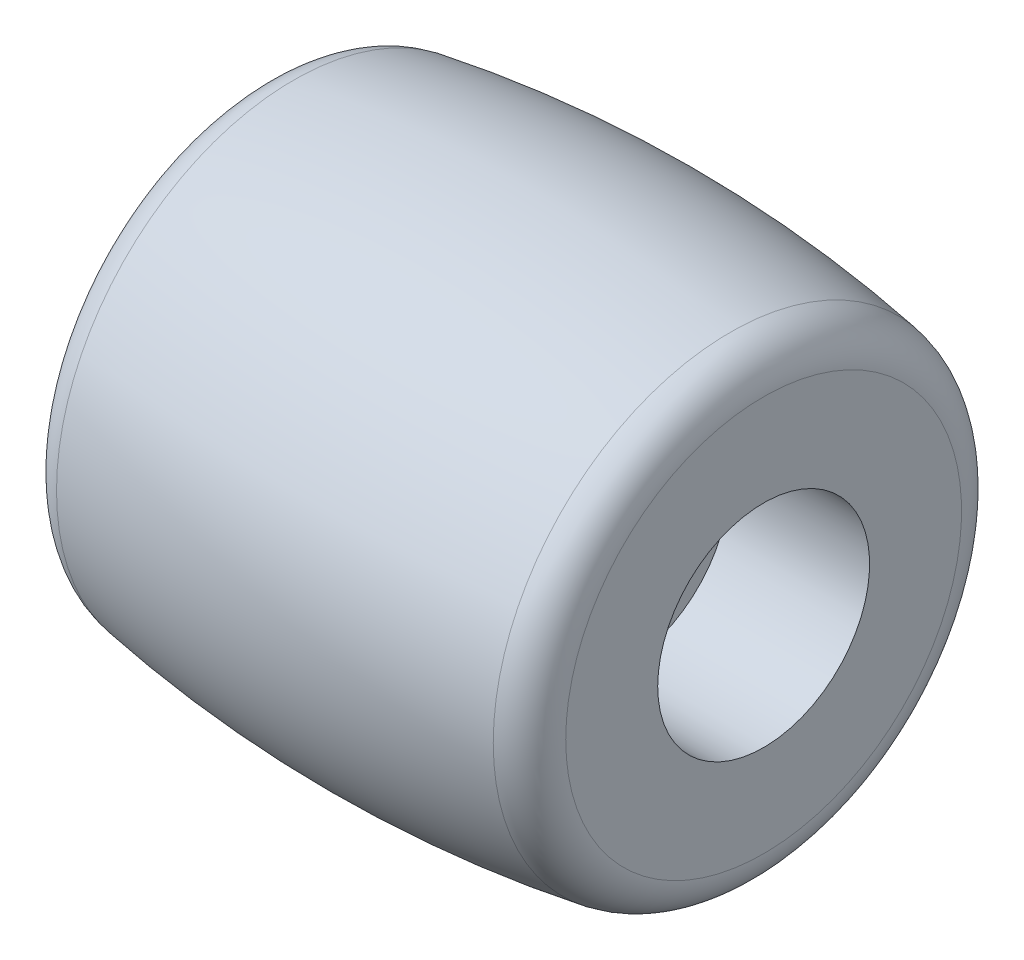
from build123d import *

# Parameters (mm, degrees)
FILLET_1_R = 1.5


with BuildPart() as part:
    # ｽｹｯﾁ1 → 回転1 (revolve)
    with BuildSketch(Plane.XY, mode=Mode.PRIVATE) as revolve_1_sk:
        with BuildLine():
            Line((4.2, 2.5), (-4.2, 2.5))
            Line((-4.2, 2.5), (-4.2, 4))
            Line((-4.2, 4), (-9.5, 4))
            Line((-9.5, 4), (-9.5, 8.72880747))
            ThreePointArc((-9.5, 8.72880747), (0, 9.625), (9.5, 8.72880747))
            Line((9.5, 8.72880747), (9.5, 4))
            Line((9.5, 4), (4.2, 4))
            Line((4.2, 4), (4.2, 2.5))
        make_face()
    revolve(revolve_1_sk.sketch.rotate(Axis((0, 0, 0), (1, 0, 0)), 90), axis=Axis((0, 0, 0), (1, 0, 0)))

    # ﾌｨﾚｯﾄ1
    fillet_1_edges = [part.edges().sort_by_distance(p)[0] for p in [
        (9.5, 0, -8.72880747),
        (-9.5, 0, -8.72880747),
    ]]
    fillet(fillet_1_edges, radius=FILLET_1_R)


solid = part.part
